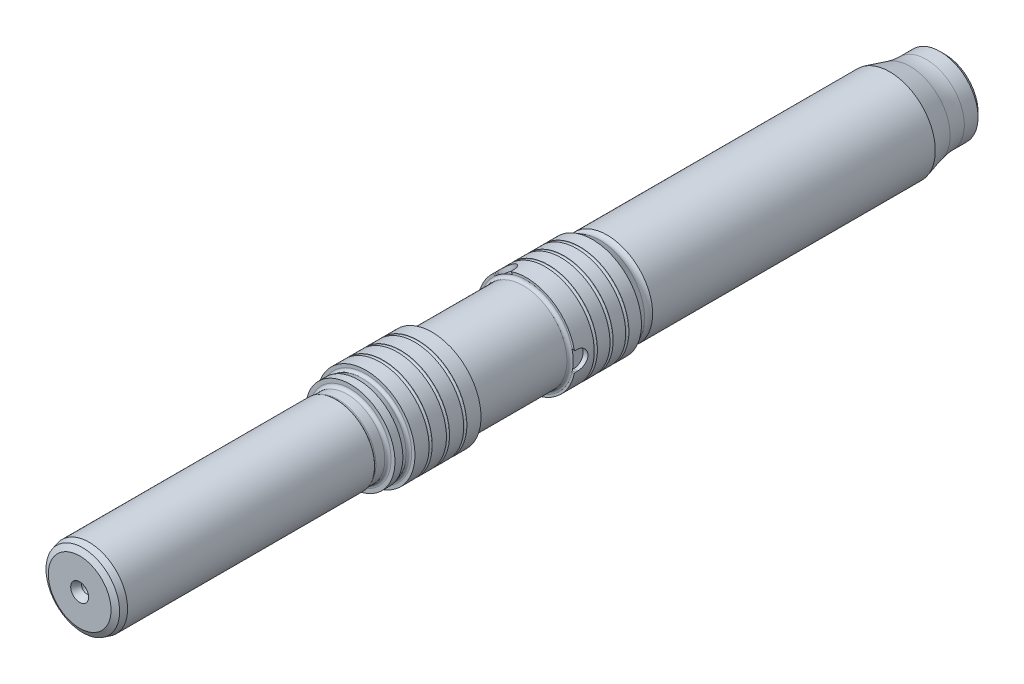
from build123d import *

# Parameters (mm, degrees)
CUT_EXTRUDE1_DEPTH = 1.55
CIRPATTERN1_COUNT  = 3


with BuildPart() as part:
    # Sketch1 → Revolve1 (revolve)
    with BuildSketch(Plane(origin=(0, 0, 0), x_dir=(0, 0, -1), z_dir=(1, 0, 0)), mode=Mode.PRIVATE) as revolve1_sk:
        with BuildLine():
            Line((-17.5, 14.4875), (-107.351574436, 14.4875))
            ThreePointArc((-107.351574436, 14.4875), (-108.480333208, 13.985861828), (-109.688490196, 14.242949192))
            Line((-109.688490196, 14.242949192), (-112, 15.5775))
            Line((-112, 15.5775), (-116, 15.5775))
            Line((-116, 15.5775), (-116, 15.45))
            ThreePointArc((-116, 15.45), (-116.5, 14.95), (-117, 15.45))
            Line((-117, 15.45), (-117, 15.5775))
            Line((-117, 15.5775), (-121, 15.5775))
            Line((-121, 15.5775), (-121, 15.45))
            ThreePointArc((-121, 15.45), (-121.5, 14.95), (-122, 15.45))
            Line((-122, 15.45), (-122, 15.5775))
            Line((-122, 15.5775), (-126, 15.5775))
            Line((-126, 15.5775), (-126, 15.45))
            ThreePointArc((-126, 15.45), (-126.5, 14.95), (-127, 15.45))
            Line((-127, 15.45), (-127, 15.5775))
            Line((-127, 15.5775), (-133, 15.5775))
            Line((-133, 15.5775), (-133, 14.875))
            ThreePointArc((-133, 14.875), (-133.292893219, 14.167893219), (-134, 13.875))
            Line((-134, 13.875), (-162, 13.875))
            ThreePointArc((-162, 13.875), (-162.707106781, 14.167893219), (-163, 14.875))
            Line((-163, 14.875), (-163, 15.5775))
            Line((-163, 15.5775), (-167.5, 15.5775))
            Line((-167.5, 15.5775), (-167.5, 15.45))
            ThreePointArc((-167.5, 15.45), (-168, 14.95), (-168.5, 15.45))
            Line((-168.5, 15.45), (-168.5, 15.5775))
            Line((-168.5, 15.5775), (-173, 15.5775))
            Line((-173, 15.5775), (-173, 15.45))
            ThreePointArc((-173, 15.45), (-173.5, 14.95), (-174, 15.45))
            Line((-174, 15.45), (-174, 15.5775))
            Line((-174, 15.5775), (-178.5, 15.5775))
            Line((-178.5, 15.5775), (-178.5, 15.45))
            ThreePointArc((-178.5, 15.45), (-179, 14.95), (-179.5, 15.45))
            Line((-179.5, 15.45), (-179.5, 15.5775))
            Line((-179.5, 15.5775), (-184, 15.5775))
            Line((-184, 15.5775), (-184, 14.55))
            ThreePointArc((-184, 14.55), (-184.324003635, 13.907016749), (-185.033568652, 13.784855775))
            Line((-185.033568652, 13.784855775), (-186.5, 14.2325))
            Line((-186.5, 14.2325), (-189, 14.2325))
            Line((-189, 14.2325), (-189, 12.9925))
            ThreePointArc((-189, 12.9925), (-189.292893219, 12.285393219), (-190, 11.9925))
            Line((-190, 11.9925), (-192.84427521, 11.9925))
            ThreePointArc((-192.84427521, 11.9925), (-193.19427521, 12.0557503), (-193.5, 12.2375))
            Line((-193.5, 12.2375), (-272, 12.2375))
            Line((-272, 12.2375), (-274, 11.701601615))
            Line((-274, 11.701601615), (-275, 9.969550808))
            Line((-275, 9.969550808), (-275, 2.85))
            Line((-275, 2.85), (-272.79163522, 1.575))
            Line((-272.79163522, 1.575), (-269, 1.575))
            Line((-269, 1.575), (-268.053644525, 0))
            Line((-268.053644525, 0), (-6.946355475, 0))
            Line((-6.946355475, 0), (-6, 1.575))
            Line((-6, 1.575), (-2.20836478, 1.575))
            Line((-2.20836478, 1.575), (0, 2.85))
            Line((0, 2.85), (0, 10.575))
            Line((0, 10.575), (-1.5, 12.075))
            Line((-1.5, 12.075), (-5.863377475, 12.075))
            ThreePointArc((-5.863377475, 12.075), (-8.473901319, 12.246102773), (-11.039758377, 12.756483474))
            Line((-11.039758377, 12.756483474), (-17.5, 14.4875))
        make_face()
    revolve(revolve1_sk.sketch.rotate(Axis((0, 0, 0), (0, 0, 1)), 90), axis=Axis((0, 0, 0), (0, 0, 1)))

    # Sketch3 → Cut-Extrude1 (cut)
    with BuildSketch(Plane(origin=(15.57875, 0, 0), x_dir=(0, 0, -1), z_dir=(1, 0, 0))):
        with BuildLine():
            Line((-132, 3), (-132.7, 3))
            ThreePointArc((-132.7, 3), (-132.912132034, 3.087867966), (-133, 3.3))
            Line((-133, 3.3), (-133, -3.3))
            ThreePointArc((-133, -3.3), (-132.912132034, -3.087867966), (-132.7, -3))
            Line((-132.7, -3), (-132, -3))
            ThreePointArc((-132, -3), (-129, 0), (-132, 3))
        make_face()
    cut_extrude1 = extrude(amount=-CUT_EXTRUDE1_DEPTH, mode=Mode.SUBTRACT)

    # CirPattern1: Cut-Extrude1 ×3 about axis
    cirpattern1_axis = Axis((0, 0, 0), (0, 0, 1))
    for i in range(1, CIRPATTERN1_COUNT):
        add(cut_extrude1.rotate(cirpattern1_axis, i * 360 / CIRPATTERN1_COUNT), mode=Mode.SUBTRACT)


solid = part.part
